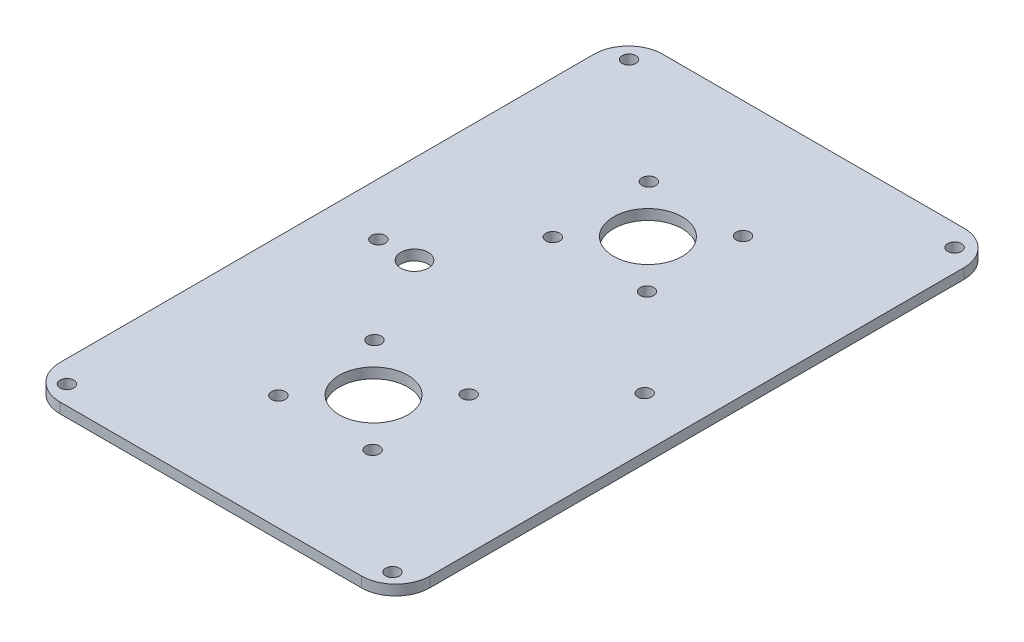
from build123d import *

# Parameters (mm, degrees)
SKETCH_1_R      = 2
SKETCH_1_R_2    = 10
SKETCH_1_R_3    = 4
EXTRUDE_1_DEPTH = 3


with BuildPart() as part:
    # 草图1 → 凸台-拉伸1 (new body)
    with BuildSketch(Plane(origin=(0, 0, 0), x_dir=(1, 0, 0), z_dir=(0, 1, 0))):
        with BuildLine():
            Line((-18.915, 88.196307868), (68.915, 88.196307868))
            ThreePointArc((68.915, 88.196307868), (75.986067812, 85.26737568), (78.915, 78.196307868))
            Line((78.915, 78.196307868), (78.915, -77.463692132))
            ThreePointArc((78.915, -77.463692132), (75.986067812, -84.534759944), (68.915, -87.463692132))
            Line((68.915, -87.463692132), (-18.915, -87.463692132))
            ThreePointArc((-18.915, -87.463692132), (-25.986067812, -84.534759944), (-28.915, -77.463692132))
            Line((-28.915, -77.463692132), (-28.915, 78.196307868))
            ThreePointArc((-28.915, 78.196307868), (-25.986067812, 85.26737568), (-18.915, 88.196307868))
        make_face()
        with Locations(Location((72.465, 81.936307868, 0), (0, 0, 270))):
            Circle(SKETCH_1_R, mode=Mode.SUBTRACT)
        with Locations(Location((72.465, -81.936307868, 0), (0, 0, 270))):
            Circle(SKETCH_1_R, mode=Mode.SUBTRACT)
        with Locations(Location((-22.465, -81.936307868, 0), (0, 0, 270))):
            Circle(SKETCH_1_R, mode=Mode.SUBTRACT)
        with Locations(Location((-22.465, 81.936307868, 0), (0, 0, 270))):
            Circle(SKETCH_1_R, mode=Mode.SUBTRACT)
        with Locations(Location((25, 40, 0), (0, 0, 270))):
            Circle(SKETCH_1_R_2, mode=Mode.SUBTRACT)
        with Locations(Location((11.26703509, 54, 0), (0, 0, 270))):
            Circle(SKETCH_1_R, mode=Mode.SUBTRACT)
        with Locations(Location((38.73296491, 54, 0), (0, 0, 270))):
            Circle(SKETCH_1_R, mode=Mode.SUBTRACT)
        with Locations(Location((38.73296491, 26, 0), (0, 0, 270))):
            Circle(SKETCH_1_R, mode=Mode.SUBTRACT)
        with Locations(Location((11.26703509, 26, 0), (0, 0, 270))):
            Circle(SKETCH_1_R, mode=Mode.SUBTRACT)
        with Locations(Location((11.26703509, -26, 0), (0, 0, 270))):
            Circle(SKETCH_1_R, mode=Mode.SUBTRACT)
        with Locations(Location((11.26703509, -54, 0), (0, 0, 270))):
            Circle(SKETCH_1_R, mode=Mode.SUBTRACT)
        with Locations(Location((25, -40, 0), (0, 0, 270))):
            Circle(SKETCH_1_R_2, mode=Mode.SUBTRACT)
        with Locations(Location((38.73296491, -26, 0), (0, 0, 270))):
            Circle(SKETCH_1_R, mode=Mode.SUBTRACT)
        with Locations(Location((38.73296491, -54, 0), (0, 0, 270))):
            Circle(SKETCH_1_R, mode=Mode.SUBTRACT)
        with Locations(Location((64.051731017, -0.006153743, 0), (0, 0, 270))):
            Circle(SKETCH_1_R, mode=Mode.SUBTRACT)
        with Locations(Location((-3.064799971, -0.006153743, 0), (0, 0, 270))):
            Circle(SKETCH_1_R_3, mode=Mode.SUBTRACT)
        with Locations(Location((-13.600868083, -0.006153743, 0), (0, 0, 270))):
            Circle(SKETCH_1_R, mode=Mode.SUBTRACT)
    extrude(amount=EXTRUDE_1_DEPTH)


solid = part.part
